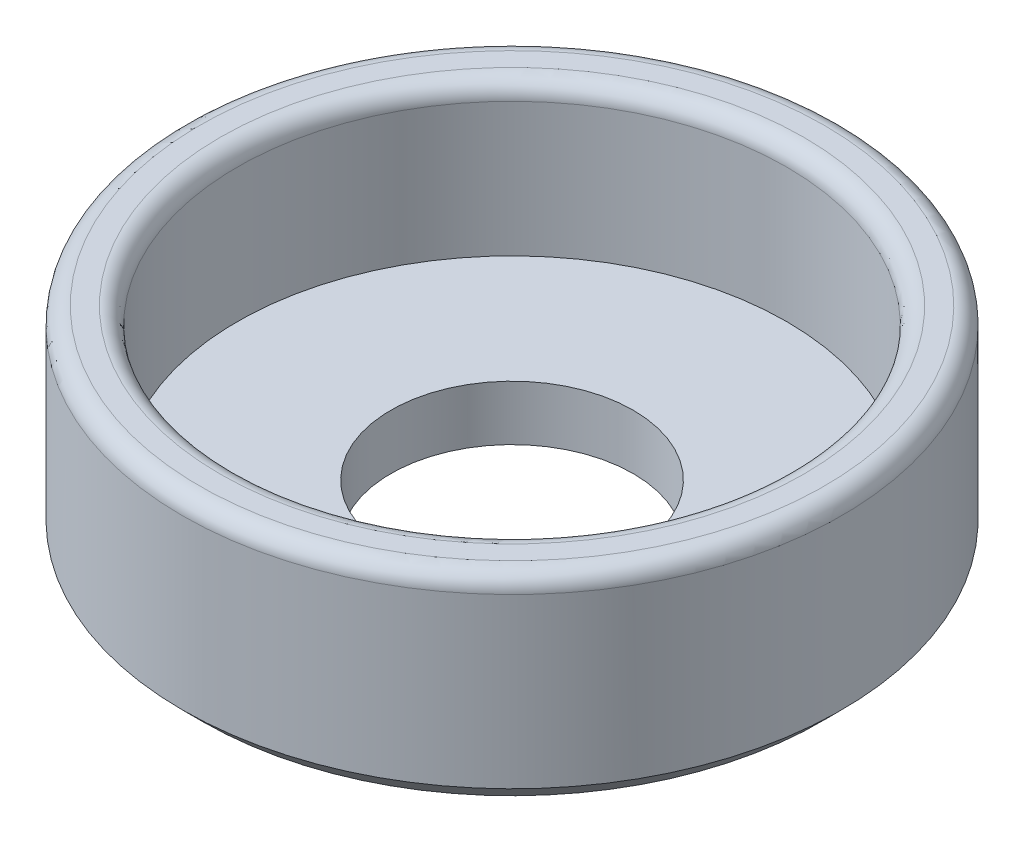
from build123d import *

# Parameters (mm, degrees)
SKETCH2_R          = 1.765
CUT_EXTRUDE1_DEPTH = 8.13582511
FILLET1_R          = 0.25
CHAMFER1_SIZE      = 0.3


with BuildPart() as part:
    # Sketch1 → Revolve1 (revolve)
    with BuildSketch(Plane.XY, mode=Mode.PRIVATE) as revolve1_sk:
        Polygon((0, 0), (4.8, 0), (4.8, 3), (4, 3), (4, 0.8), (0, 0.8), align=None)
    revolve(revolve1_sk.sketch.rotate(Axis((0, 0.8, 0), (0, -1, 0)), 90), axis=Axis((0, 0.8, 0), (0, -1, 0)))

    # Sketch2 → Cut-Extrude1 (cut, through all)
    with BuildSketch(Plane(origin=(0, 0.8, 0), x_dir=(1, 0, 0), z_dir=(0, 1, 0))):
        with Locations(Location((0, 0, 0), (0, 0, 270))):
            Circle(SKETCH2_R)
    extrude(amount=-CUT_EXTRUDE1_DEPTH, mode=Mode.SUBTRACT)

    # Fillet1
    fillet1_edges = [part.edges().sort_by_distance(p)[0] for p in [
        (0, 3, -4),
        (0, 3, -4.8),
    ]]
    fillet(fillet1_edges, radius=FILLET1_R)

    # Chamfer1
    chamfer1_edges = [part.edges().sort_by_distance(p)[0] for p in [
        (0, 0, -4.8),
    ]]
    chamfer(chamfer1_edges, length=CHAMFER1_SIZE)


solid = part.part
